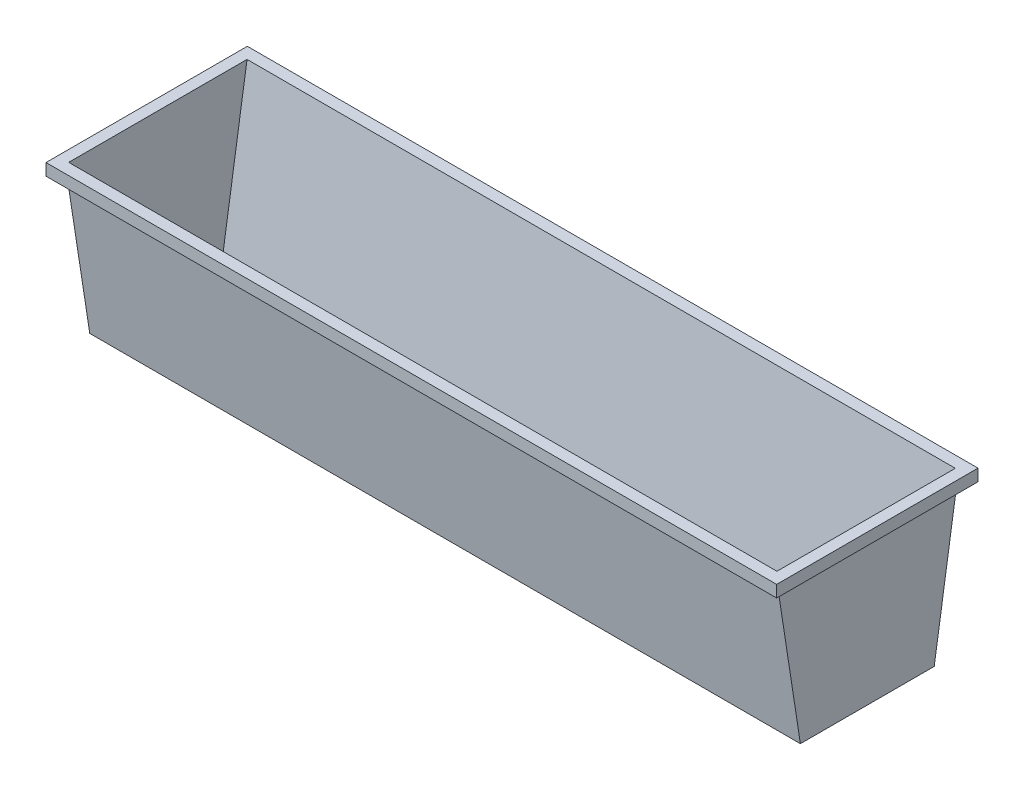
from build123d import *

# Parameters (mm, degrees)
BOSS_EXTRUDE1_DEPTH = 300
SKETCH2_W           = 616.91666666
SKETCH2_H           = 169.999999994
BOSS_EXTRUDE2_DEPTH = 5
CUT_EXTRUDE1_START  = -300
CUT_EXTRUDE1_DEPTH  = 299


with BuildPart() as part:
    # Sketch1 → Boss-Extrude1 (new, symmetric)
    with BuildSketch(Plane(origin=(0, 0, 0), x_dir=(0, 0, -1), z_dir=(1, 0, 0))):
        Polygon((0, 0), (113, 0), (133.041666667, 130), (-20.041666667, 130), align=None)
    extrude(amount=BOSS_EXTRUDE1_DEPTH, both=True)

    # Sketch2 → Boss-Extrude2 (add, symmetric)
    with BuildSketch(Plane(origin=(0, 130, 0), x_dir=(1, 0, 0), z_dir=(0, 1, 0))):
        with Locations((0, 56.5)):
            Rectangle(SKETCH2_W, SKETCH2_H)
    extrude(amount=BOSS_EXTRUDE2_DEPTH, both=True)

    # Sketch3 → Cut-Extrude1 (cut, symmetric)
    with BuildSketch(Plane.ZY.offset(300).offset(CUT_EXTRUDE1_START)):
        Polygon((-131.788872207, 135), (18.788872207, 135), (-1.71529446, 2), (-111.28470554, 2), align=None)
    extrude(amount=CUT_EXTRUDE1_DEPTH, both=True, mode=Mode.SUBTRACT)


solid = part.part
